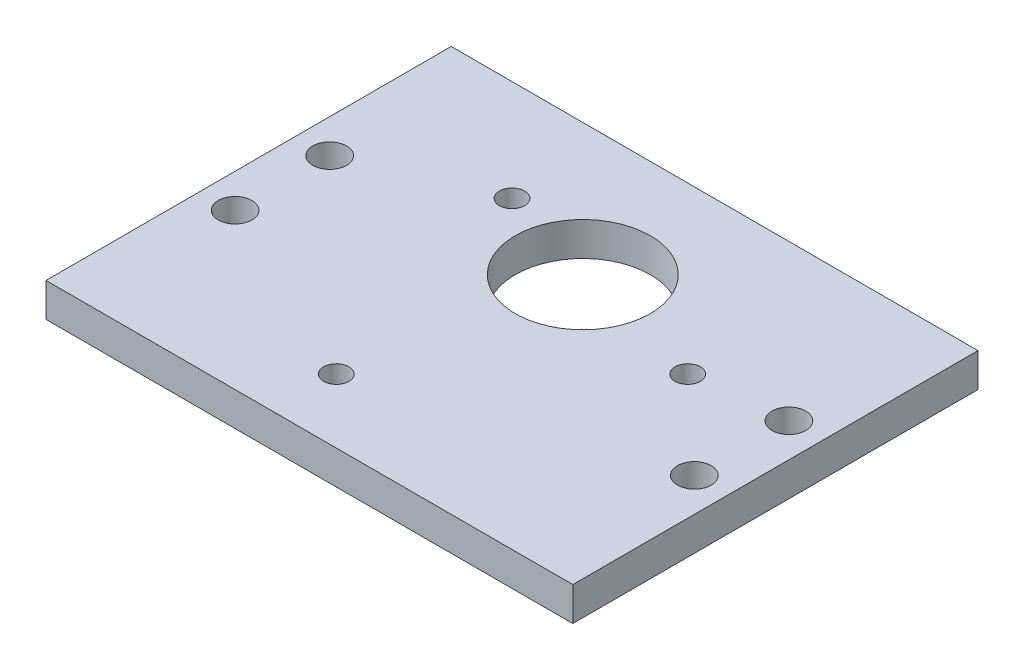
from build123d import *

# Parameters (mm, degrees)
SKETCH1_W           = 49.53
SKETCH1_H           = 38.1
BOSS_EXTRUDE1_DEPTH = 3.175
SKETCH4_R           = 1.190625
SKETCH4_R_2         = 6.35
SKETCH4_R_3         = 1.5875
CUT_EXTRUDE2_DEPTH  = 63.569253831


with BuildPart() as part:
    # Sketch1 → Boss-Extrude1 (new body)
    with BuildSketch(Plane(origin=(0, 0, 0), x_dir=(1, 0, 0), z_dir=(0, 1, 0))):
        with Locations((24.765, 19.05)):
            Rectangle(SKETCH1_W, SKETCH1_H)
    extrude(amount=BOSS_EXTRUDE1_DEPTH)

    # Sketch4 → Cut-Extrude2 (cut, through all)
    with BuildSketch(Plane.XZ):
        with Locations(Location((21.274204011, -6.022172011, 0), (0, 0, 270))):
            Circle(SKETCH4_R)
        with Locations(Location((37.792827989, -22.540795989, 0), (0, 0, 270))):
            Circle(SKETCH4_R)
        with Locations(Location((15.227967999, -28.587032001, 0), (0, 0, 270))):
            Circle(SKETCH4_R)
        with Locations(Location((24.765, -25.7048, 0), (0, 0, 270))):
            Circle(SKETCH4_R_2)
        with Locations(Location((3.175, -23.495, 0), (0, 0, 270))):
            Circle(SKETCH4_R_3)
        with Locations(Location((3.175, -14.605, 0), (0, 0, 90))):
            Circle(SKETCH4_R_3)
        with Locations(Location((46.355, -14.605, 0), (0, 0, 270))):
            Circle(SKETCH4_R_3)
        with Locations(Location((46.355, -23.495, 0), (0, 0, 90))):
            Circle(SKETCH4_R_3)
    extrude(amount=-CUT_EXTRUDE2_DEPTH, mode=Mode.SUBTRACT)


solid = part.part
